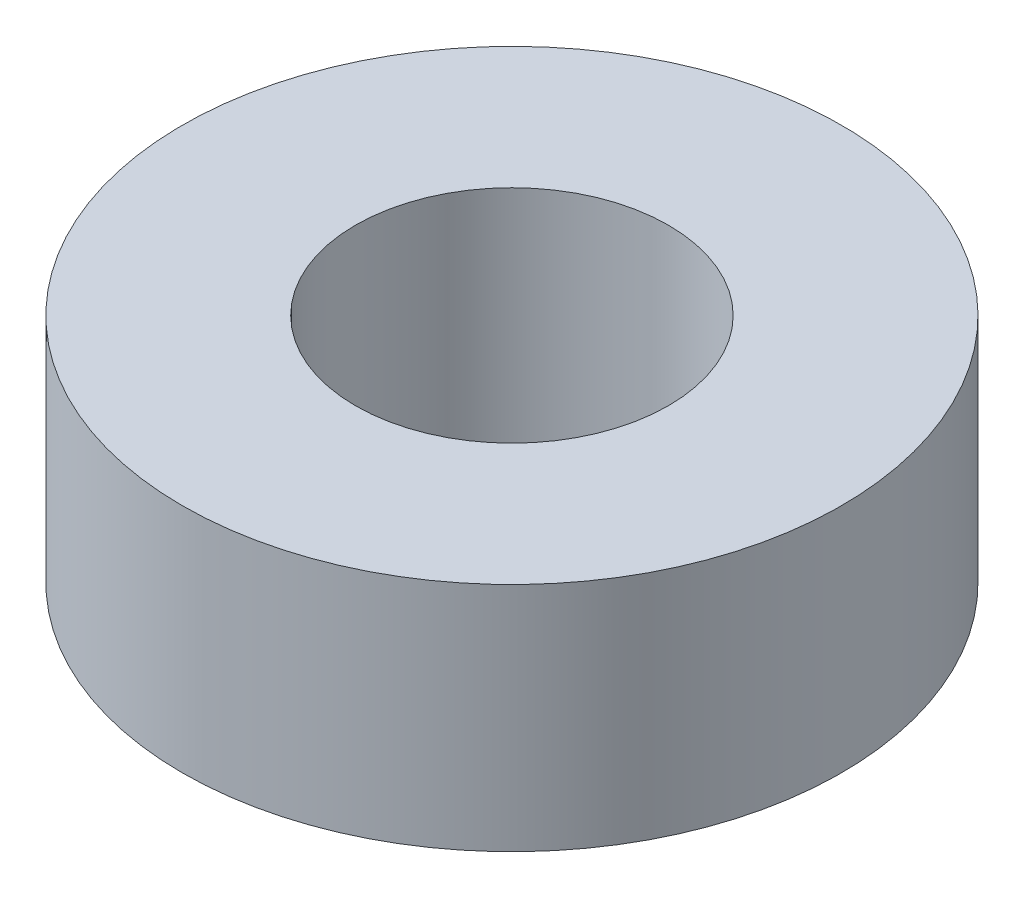
from build123d import *

# Parameters (mm, degrees)
SKETCH1_R           = 12.36
BOSS_EXTRUDE1_DEPTH = 8.678
SKETCH2_R           = 5.8674
CUT_EXTRUDE1_DEPTH  = 20.515298717


with BuildPart() as part:
    # Sketch1 → Boss-Extrude1 (new body)
    with BuildSketch(Plane(origin=(0, 0, 0), x_dir=(1, 0, 0), z_dir=(0, 1, 0))):
        with Locations(Location((0, 0, 0), (0, 0, 270))):
            Circle(SKETCH1_R)
    extrude(amount=BOSS_EXTRUDE1_DEPTH)

    # Sketch2 → Cut-Extrude1 (cut, through all)
    with BuildSketch(Plane(origin=(0, 0, 0), x_dir=(-1, 0, 0), z_dir=(0, -1, 0))):
        with Locations(Location((0, 0, 0), (0, 0, 90))):
            Circle(SKETCH2_R)
    extrude(amount=-CUT_EXTRUDE1_DEPTH, mode=Mode.SUBTRACT)


solid = part.part
